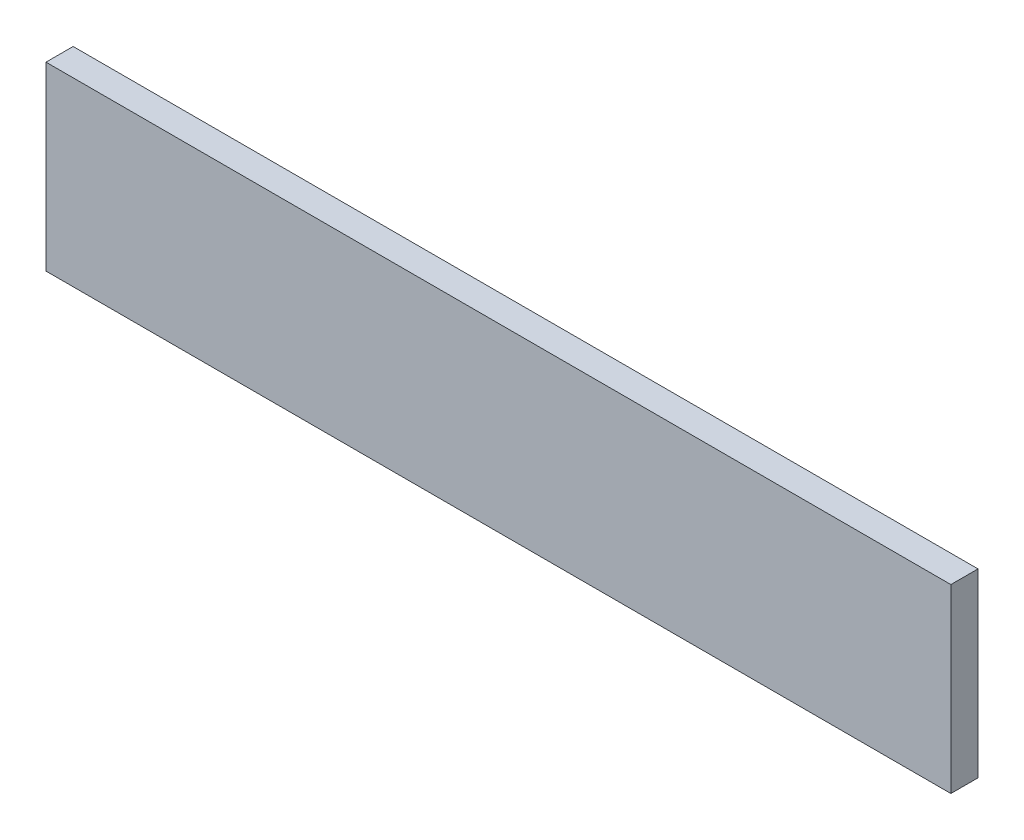
from build123d import *

# Parameters (mm, degrees)
ESQUISSE1_W          = 100
ESQUISSE1_H          = 20
BASE_EXTRUSION_DEPTH = 3


with BuildPart() as part:
    # Esquisse1 → Base-Extrusion (new body)
    with BuildSketch(Plane.XY):
        with Locations((91, -26.461316052)):
            Rectangle(ESQUISSE1_W, ESQUISSE1_H)
    extrude(amount=BASE_EXTRUSION_DEPTH)


solid = part.part
